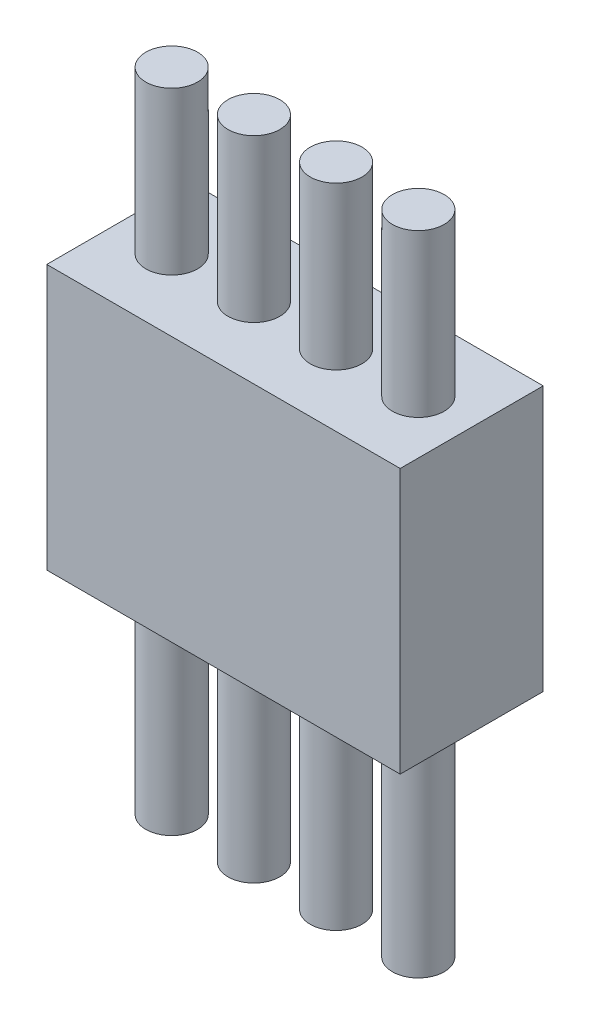
from build123d import *

# Parameters (mm, degrees)
SKETCH1_W           = 5.46
SKETCH1_H           = 4.09
BOSS_EXTRUDE1_DEPTH = 1.105
BOSS_EXTRUDE2_START = -7.5
SKETCH2_R           = 0.4
BOSS_EXTRUDE2_DEPTH = 10


with BuildPart() as part:
    # Sketch1 → Boss-Extrude1 (new, symmetric)
    with BuildSketch(Plane.XY):
        Rectangle(SKETCH1_W, SKETCH1_H)
    extrude(amount=BOSS_EXTRUDE1_DEPTH, both=True)

    # Sketch2 → Boss-Extrude2 (add)
    with BuildSketch(Plane(origin=(0, 2.045, 0), x_dir=(1, 0, 0), z_dir=(0, 1, 0)).offset(BOSS_EXTRUDE2_START)):
        with Locations(Location((-1.905, 0, 0), (0, 0, 270))):
            Circle(SKETCH2_R)
        with Locations(Location((-0.635, 0, 0), (0, 0, 270))):
            Circle(SKETCH2_R)
        with Locations(Location((0.635, 0, 0), (0, 0, 270))):
            Circle(SKETCH2_R)
        with Locations(Location((1.905, 0, 0), (0, 0, 270))):
            Circle(SKETCH2_R)
    extrude(amount=BOSS_EXTRUDE2_DEPTH)


solid = part.part
